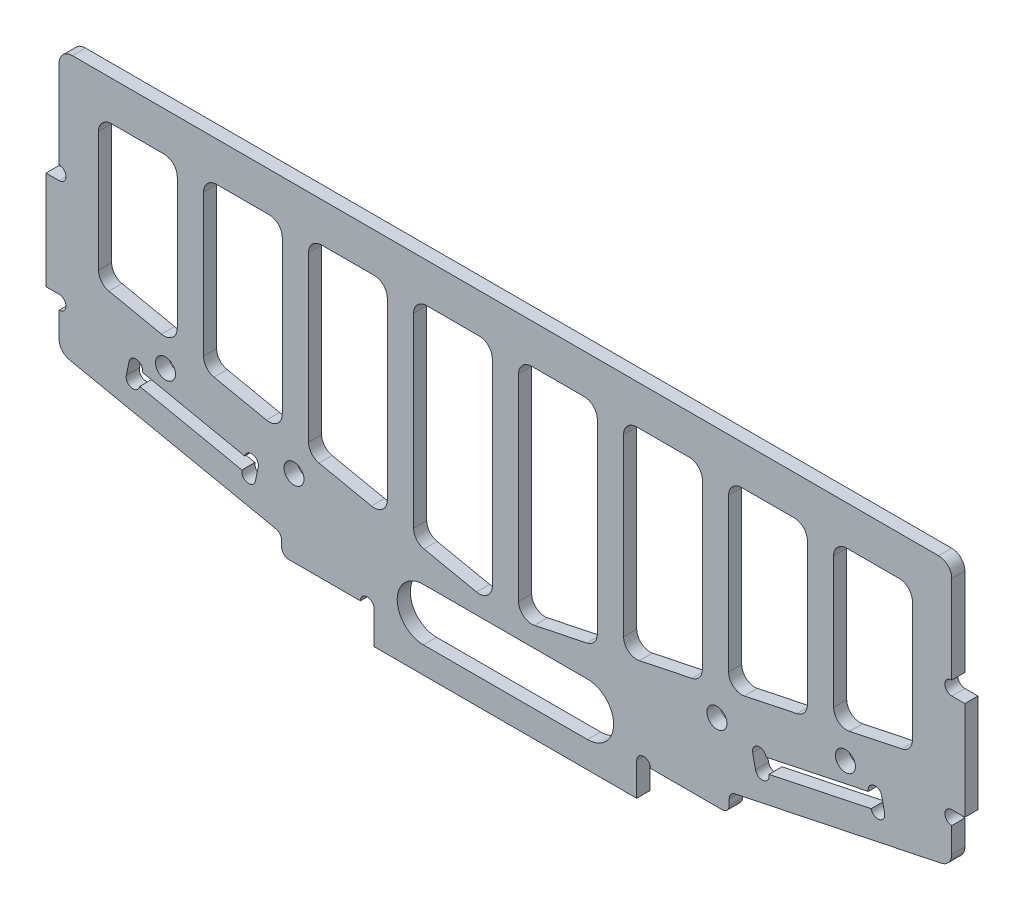
from build123d import *

# Parameters (mm, degrees)
SKETCH_1_W           = 136
SKETCH_1_H           = 50
EXTRUDE_1_DEPTH      = 2
SKETCH_2_W           = 4
SKETCH_2_H           = 15
EXTRUDE_2_DEPTH      = 2
SKETCH_3_R           = 1.05
CUT_EXTRUDE_1_DEPTH  = 2
CUT_EXTRUDE_3_DEPTH  = 2
SKETCH_5_R           = 1.05
CUT_EXTRUDE_4_DEPTH  = 10
SKETCH_6_R           = 1.05
CUT_EXTRUDE_5_DEPTH  = 10
SKETCH_7_W           = 40
SKETCH_7_H           = 10
EXTRUDE_3_DEPTH      = 2
SKETCH_8_R           = 1.05
CUT_EXTRUDE_6_DEPTH  = 10
SKETCH_9_R           = 1.525
CUT_EXTRUDE_7_DEPTH  = 22
CUT_EXTRUDE_8_DEPTH  = 22
FILLET_1_R           = 1.1
FILLET_2_R           = 2
CUT_EXTRUDE_9_DEPTH  = 22
FILLET_3_R           = 2
CUT_EXTRUDE_10_DEPTH = 2


with BuildPart() as part:
    # 草图1 → 凸台-拉伸1 (new body)
    with BuildSketch(Plane.XY):
        Rectangle(SKETCH_1_W, SKETCH_1_H)
    extrude(amount=EXTRUDE_1_DEPTH)

    # 草图2 → 凸台-拉伸2 (add)
    with BuildSketch(Plane.XY.offset(2)):
        with Locations((68, 0)):
            Rectangle(SKETCH_2_W, SKETCH_2_H)
    extrude_2 = extrude(amount=-EXTRUDE_2_DEPTH)

    # 镜向1: 凸台-拉伸2 across plane
    add(extrude_2.mirror(Plane(origin=(0, 0, 0), x_dir=(0, 0, 1), z_dir=(1, 0, 0))))

    # 草图3 → 切除-拉伸1 (cut)
    with BuildSketch(Plane(origin=(0, 0, 0), x_dir=(-1, 0, 0), z_dir=(0, 0, -1))):
        with Locations((68, 8.55)):
            Circle(SKETCH_3_R)
        with Locations((68, -8.55)):
            Circle(SKETCH_3_R)
        with Locations((-68, 8.55)):
            Circle(SKETCH_3_R)
        with Locations((-68, -8.55)):
            Circle(SKETCH_3_R)
    extrude(amount=-CUT_EXTRUDE_1_DEPTH, mode=Mode.SUBTRACT)

    # 草图4 → 切除-拉伸3 (cut)
    with BuildSketch(Plane.XY.offset(2)):
        Polygon((38.094522867, -17.190550425), (57.770246389, -13.082521228), (57.341049309, -11.026848621), (37.665325786, -15.134877819), align=None)
    cut_extrude_3 = extrude(amount=-CUT_EXTRUDE_3_DEPTH, mode=Mode.SUBTRACT)

    # 草图5 → 切除-拉伸4 (cut)
    with BuildSketch(Plane.XY.offset(2)):
        with Locations((39.12235917, -16.975951885)):
            Circle(SKETCH_5_R)
        with Locations((56.742410085, -13.297119768)):
            Circle(SKETCH_5_R)
    cut_extrude_4 = extrude(amount=-CUT_EXTRUDE_4_DEPTH, mode=Mode.SUBTRACT)

    # 草图6 → 切除-拉伸5 (cut)
    with BuildSketch(Plane.XY.offset(2)):
        with Locations((38.69316209, -14.920279278)):
            Circle(SKETCH_6_R)
        with Locations((56.313213005, -11.241447162)):
            Circle(SKETCH_6_R)
    cut_extrude_5 = extrude(amount=-CUT_EXTRUDE_5_DEPTH, mode=Mode.SUBTRACT)

    # 镜向2: 切除-拉伸3, 切除-拉伸4, 切除-拉伸5 across plane
    add(cut_extrude_3.mirror(Plane(origin=(0, 0, 0), x_dir=(0, 0, 1), z_dir=(1, 0, 0))), mode=Mode.SUBTRACT)
    add(cut_extrude_4.mirror(Plane(origin=(0, 0, 0), x_dir=(0, 0, 1), z_dir=(1, 0, 0))), mode=Mode.SUBTRACT)
    add(cut_extrude_5.mirror(Plane(origin=(0, 0, 0), x_dir=(0, 0, 1), z_dir=(1, 0, 0))), mode=Mode.SUBTRACT)

    # 草图7 → 凸台-拉伸3 (add)
    with BuildSketch(Plane.XY.offset(2)):
        with Locations((0, -25)):
            Rectangle(SKETCH_7_W, SKETCH_7_H)
    extrude(amount=-EXTRUDE_3_DEPTH)

    # 草图8 → 切除-拉伸6 (cut)
    with BuildSketch(Plane(origin=(0, 0, 0), x_dir=(-1, 0, 0), z_dir=(0, 0, -1))):
        with Locations((21.05, -25)):
            Circle(SKETCH_8_R)
        with Locations((-21.05, -25)):
            Circle(SKETCH_8_R)
    extrude(amount=-CUT_EXTRUDE_6_DEPTH, mode=Mode.SUBTRACT)

    # 草图9 → 切除-拉伸7 (cut)
    with BuildSketch(Plane(origin=(0, 0, 0), x_dir=(-1, 0, 0), z_dir=(0, 0, -1))):
        with Locations((-51.794726427, -9.171234843)):
            Circle(SKETCH_9_R)
        with Locations((-32.216892077, -13.258826084)):
            Circle(SKETCH_9_R)
    cut_extrude_7 = extrude(amount=-CUT_EXTRUDE_7_DEPTH, mode=Mode.SUBTRACT)

    # 镜向3: 切除-拉伸7 across plane
    add(cut_extrude_7.mirror(Plane(origin=(0, 0, 0), x_dir=(0, 0, 1), z_dir=(1, 0, 0))), mode=Mode.SUBTRACT)

    # 草图10 → 切除-拉伸8 (cut)
    with BuildSketch(Plane(origin=(0, 0, 0), x_dir=(-1, 0, 0), z_dir=(0, 0, -1))):
        Polygon((-68, -15.032938627), (-34.1, -22.110807434), (-34.1, -25), (-68, -25), align=None)
    cut_extrude_8 = extrude(amount=-CUT_EXTRUDE_8_DEPTH, mode=Mode.SUBTRACT)

    # 镜向4: 切除-拉伸8 across plane
    add(cut_extrude_8.mirror(Plane(origin=(0, 0, 0), x_dir=(0, 0, 1), z_dir=(1, 0, 0))), mode=Mode.SUBTRACT)

    # 圆角1
    fillet_1_edges = [part.edges().sort_by_distance(p)[0] for p in [
        (34.1, -25, 1),
        (34.1, -22.110807434, 1),
        (-34.1, -25, 1),
        (-34.1, -22.110807434, 1),
    ]]
    fillet(fillet_1_edges, radius=FILLET_1_R)

    # 圆角2
    fillet_2_edges = [part.edges().sort_by_distance(p)[0] for p in [
        (68, -15.032938627, 1),
        (-68, -15.032938627, 1),
        (-68, 25, 1),
        (68, 25, 1),
    ]]
    fillet(fillet_2_edges, radius=FILLET_2_R)

    # 草图11 → 切除-拉伸9 (cut)
    with BuildSketch(Plane(origin=(0, 0, 0), x_dir=(-1, 0, 0), z_dir=(0, 0, -1))):
        Polygon((14, 19), (2, 19), (2, -15.481457178), (14, -12.976016892), align=None)
        Polygon((30, 19), (18, 19), (18, -12.14087013), (30, -9.635429844), align=None)
        Polygon((46, 19), (34, 19), (34, -8.800283082), (46, -6.294842797), align=None)
        Polygon((62, 19), (50, 19), (50, -5.459696035), (62, -2.954255749), align=None)
    cut_extrude_9 = extrude(amount=-CUT_EXTRUDE_9_DEPTH, mode=Mode.SUBTRACT)

    # 镜向5: 切除-拉伸9 across plane
    add(cut_extrude_9.mirror(Plane(origin=(0, 0, 0), x_dir=(0, 0, 1), z_dir=(1, 0, 0))), mode=Mode.SUBTRACT)

    # 圆角3
    fillet_3_edges = [part.edges().sort_by_distance(p)[0] for p in [
        (-14, 19, 1),
        (-14, -12.976016892, 1),
        (-2, -15.481457178, 1),
        (-2, 19, 1),
        (-30, 19, 1),
        (-30, -9.635429844, 1),
        (-18, -12.14087013, 1),
        (-18, 19, 1),
        (-46, 19, 1),
        (-46, -6.294842797, 1),
        (-34, -8.800283082, 1),
        (-34, 19, 1),
        (-50, 19, 1),
        (-62, 19, 1),
        (-62, -2.954255749, 1),
        (-50, -5.459696035, 1),
        (14, -12.976016892, 1),
        (14, 19, 1),
        (2, 19, 1),
        (2, -15.481457178, 1),
        (30, -9.635429844, 1),
        (30, 19, 1),
        (18, 19, 1),
        (18, -12.14087013, 1),
        (46, -6.294842797, 1),
        (46, 19, 1),
        (34, 19, 1),
        (34, -8.800283082, 1),
        (62, 19, 1),
        (50, 19, 1),
        (50, -5.459696035, 1),
        (62, -2.954255749, 1),
    ]]
    fillet(fillet_3_edges, radius=FILLET_3_R)

    # 草图12 → 切除-拉伸10 (cut)
    with BuildSketch(Plane(origin=(0, 0, 0), x_dir=(-1, 0, 0), z_dir=(0, 0, -1))):
        with BuildLine():
            Line((-12.5, -18.020756897), (12.5, -18.020756897))
            ThreePointArc((12.5, -18.020756897), (16.489621551, -22.010378449), (12.5, -26))
            Line((12.5, -26), (-12.5, -26))
            ThreePointArc((-12.5, -26), (-16.489621551, -22.010378449), (-12.5, -18.020756897))
        make_face()
    extrude(amount=-CUT_EXTRUDE_10_DEPTH, mode=Mode.SUBTRACT)


solid = part.part
